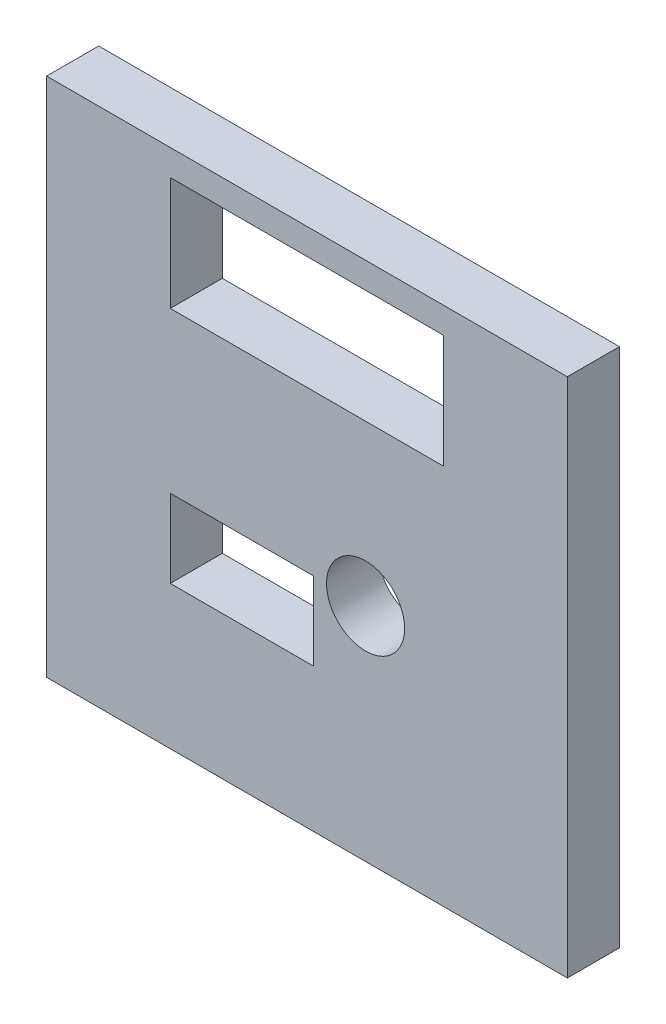
from build123d import *

# Parameters (mm, degrees)
SKETCH1_W           = 20
SKETCH1_H           = 20
BOSS_EXTRUDE1_DEPTH = 2
SKETCH2_W           = 10.5
SKETCH2_H           = 4.353558907
SKETCH2_W_2         = 5.5
SKETCH2_H_2         = 3
SKETCH2_R           = 1.5
CUT_EXTRUDE1_DEPTH  = 10


with BuildPart() as part:
    # Sketch1 → Boss-Extrude1 (new body)
    with BuildSketch(Plane.XY):
        Rectangle(SKETCH1_W, SKETCH1_H)
    extrude(amount=BOSS_EXTRUDE1_DEPTH)

    # Sketch2 → Cut-Extrude1 (cut)
    with BuildSketch(Plane.XY.offset(2)):
        with Locations((0, 6.823220546)):
            Rectangle(SKETCH2_W, SKETCH2_H)
        with Locations((-2.5, -3)):
            Rectangle(SKETCH2_W_2, SKETCH2_H_2)
        with Locations((2.25, -1.5)):
            Circle(SKETCH2_R)
    extrude(amount=-CUT_EXTRUDE1_DEPTH, mode=Mode.SUBTRACT)


solid = part.part
